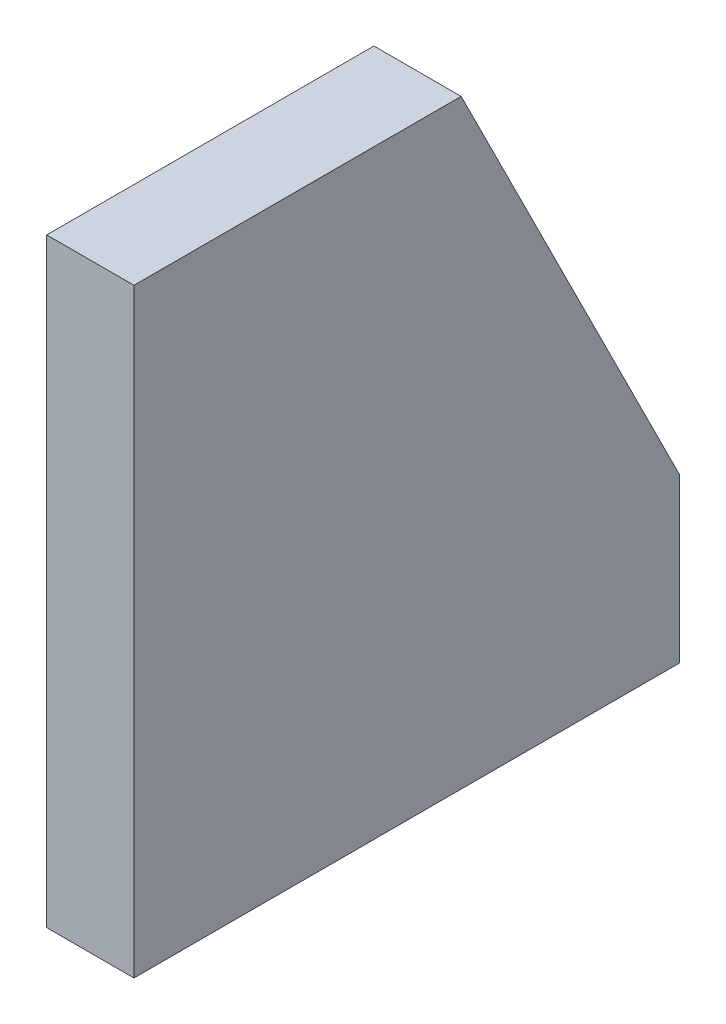
from build123d import *

# Parameters (mm, degrees)
BOSS_EXTRUDE1_DEPTH = 8


with BuildPart() as part:
    # Sketch1 → Boss-Extrude1 (new body)
    with BuildSketch(Plane(origin=(0, 0, 0), x_dir=(0, 0, -1), z_dir=(1, 0, 0))):
        Polygon((6.168831169, -11.363636364), (-43.831168831, -11.363636364), (-43.831168831, 43.636363636), (-13.831168831, 43.636363636), (6.168831169, 3.636363636), align=None)
    extrude(amount=BOSS_EXTRUDE1_DEPTH)


solid = part.part
